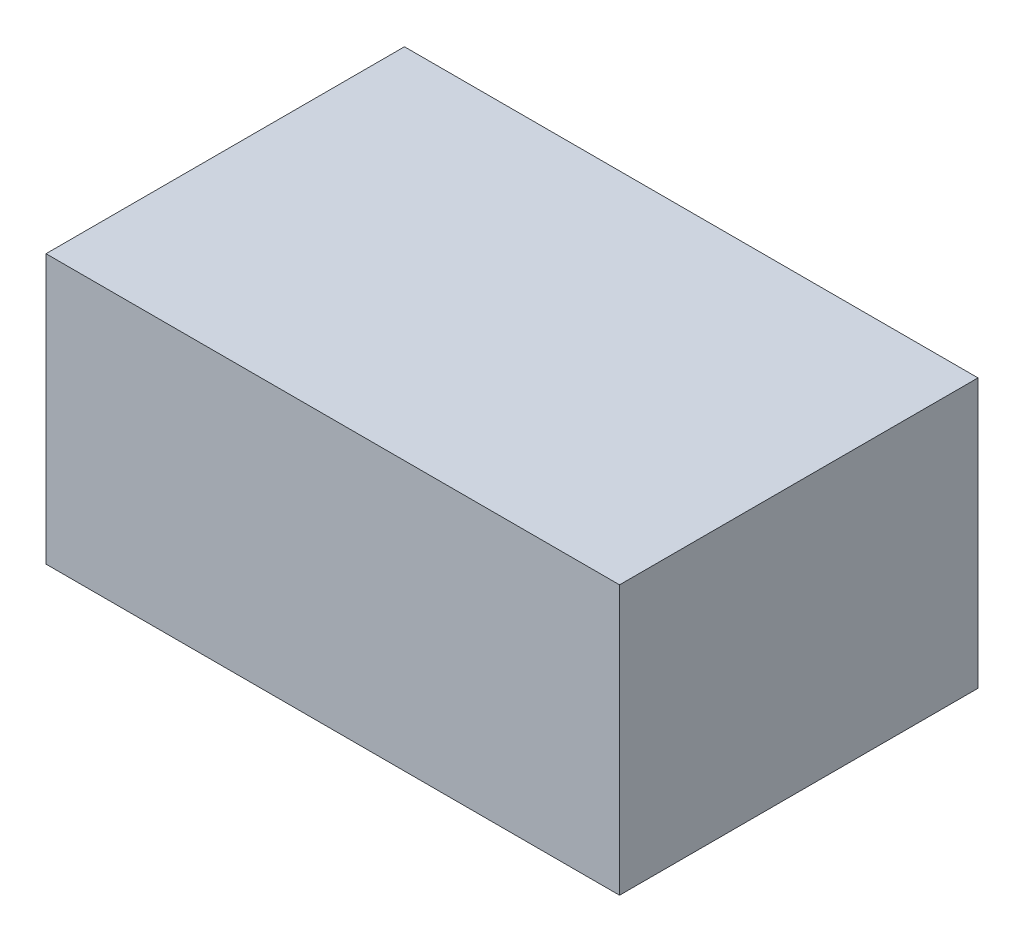
from build123d import *

# Parameters (mm, degrees)
SKETCH1_W           = 320
SKETCH1_H           = 200
BOSS_EXTRUDE1_DEPTH = 150
SHELL2_T            = 3


with BuildPart() as part:
    # Sketch1 → Boss-Extrude1 (new body)
    with BuildSketch(Plane(origin=(0, 0, 0), x_dir=(1, 0, 0), z_dir=(0, 1, 0))):
        with Locations((50.169491525, -5.762711864)):
            Rectangle(SKETCH1_W, SKETCH1_H)
    extrude(amount=BOSS_EXTRUDE1_DEPTH)

    # Shell2 (no face opened: a closed hollow body)
    add(offset(amount=-SHELL2_T, mode=Mode.PRIVATE), mode=Mode.SUBTRACT)


solid = part.part
